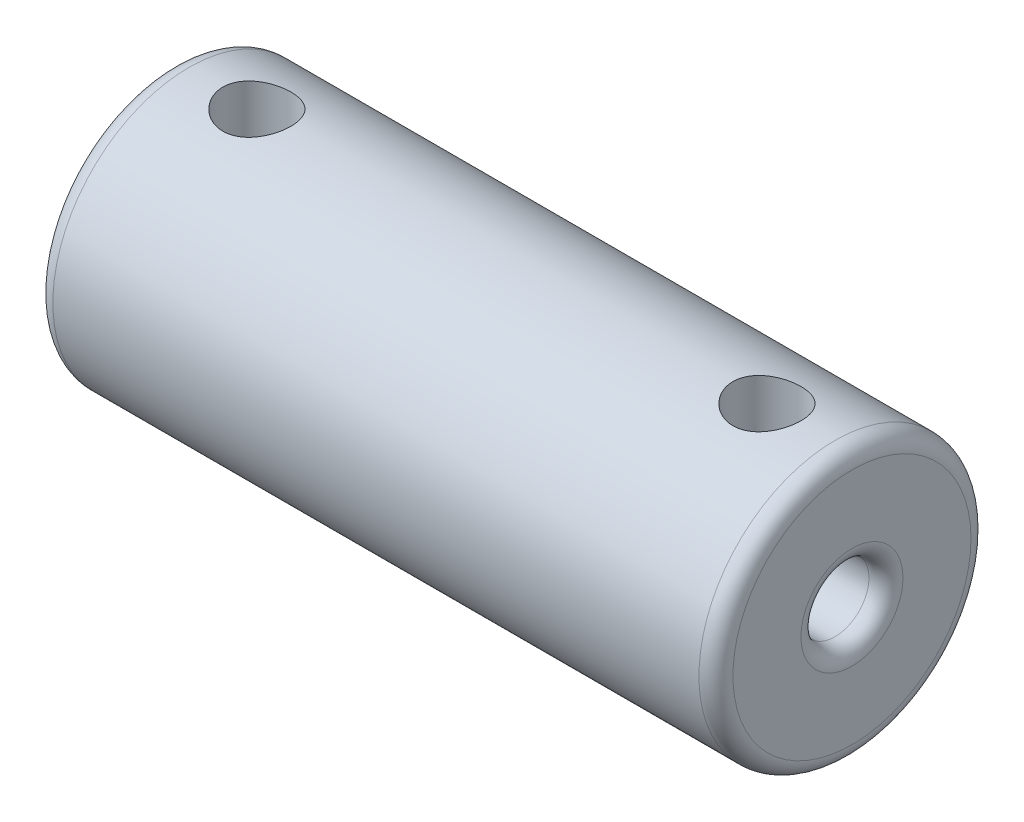
from build123d import *

# Parameters (mm, degrees)
BOSS_EXTRUDE1_DEPTH      = 10
BOSS_EXTRUDE1_DEPTH_BACK = 10
SKETCH1_R                = 4
SKETCH2_R                = 1
CUT_EXTRUDE1_DEPTH       = 10
SKETCH3_R                = 2
CUT_EXTRUDE2_DEPTH       = 10
CUT_EXTRUDE4_REACH       = 13.489
CUT_EXTRUDE4_END_RADIUS  = 4
SKETCH4_R                = 1
FILLET1_R                = 0.5


with BuildPart() as part:
    # Sketch1 → Boss-Extrude1 (new, two sides: drawn at the far end of the back side and taken through both)
    with BuildSketch(Plane(origin=(0, 0, 0), x_dir=(0, 0, -1), z_dir=(1, 0, 0)).offset(-BOSS_EXTRUDE1_DEPTH_BACK)):
        Circle(SKETCH1_R)
    extrude(amount=BOSS_EXTRUDE1_DEPTH + BOSS_EXTRUDE1_DEPTH_BACK)

    # Sketch2 → Cut-Extrude1 (cut)
    with BuildSketch(Plane(origin=(10, 0, 0), x_dir=(0, 0, -1), z_dir=(1, 0, 0))):
        Circle(SKETCH2_R)
    extrude(amount=-CUT_EXTRUDE1_DEPTH, mode=Mode.SUBTRACT)

    # Sketch3 → Cut-Extrude2 (cut)
    with BuildSketch(Plane.ZY.offset(10)):
        Circle(SKETCH3_R)
    extrude(amount=-CUT_EXTRUDE2_DEPTH, mode=Mode.SUBTRACT)

    # Cut-Extrude4: up to this cylinder (the profile starts inside it)
    cut_extrude4_end = Plane(origin=(0, 0, 0), z_dir=(1, 0, 0)) * Cylinder(CUT_EXTRUDE4_END_RADIUS, 50.978, mode=Mode.PRIVATE)
    # Sketch4 → Cut-Extrude4 (cut, up to the surface)
    with BuildSketch(Plane(origin=(0, 0, 0), x_dir=(1, 0, 0), z_dir=(0, 1, 0)), mode=Mode.PRIVATE) as cut_extrude4_sk1:
        with Locations(Location((-7.5, 0, 0), (0, 0, 90))):
            Circle(SKETCH4_R)
    cut_extrude4_tool1 = extrude(cut_extrude4_sk1.sketch, amount=CUT_EXTRUDE4_REACH, mode=Mode.PRIVATE) & cut_extrude4_end
    add(cut_extrude4_tool1.solids().sort_by_distance((-7.5, 0, 0))[0], mode=Mode.SUBTRACT)
    # Sketch4 → Cut-Extrude4 (cut, up to the surface)
    with BuildSketch(Plane(origin=(0, 0, 0), x_dir=(1, 0, 0), z_dir=(0, 1, 0)), mode=Mode.PRIVATE) as cut_extrude4_sk2:
        with Locations(Location((7.5, 0, 0), (0, 0, 90))):
            Circle(SKETCH4_R)
    cut_extrude4_tool2 = extrude(cut_extrude4_sk2.sketch, amount=CUT_EXTRUDE4_REACH, mode=Mode.PRIVATE) & cut_extrude4_end
    add(cut_extrude4_tool2.solids().sort_by_distance((7.5, 0, 0))[0], mode=Mode.SUBTRACT)

    # Fillet1
    fillet1_edges = [part.edges().sort_by_distance(p)[0] for p in [
        (-10, 0, -2),
        (-10, 0, 4),
        (10, 0, 4),
        (10, 0, 1),
    ]]
    fillet(fillet1_edges, radius=FILLET1_R)


solid = part.part
